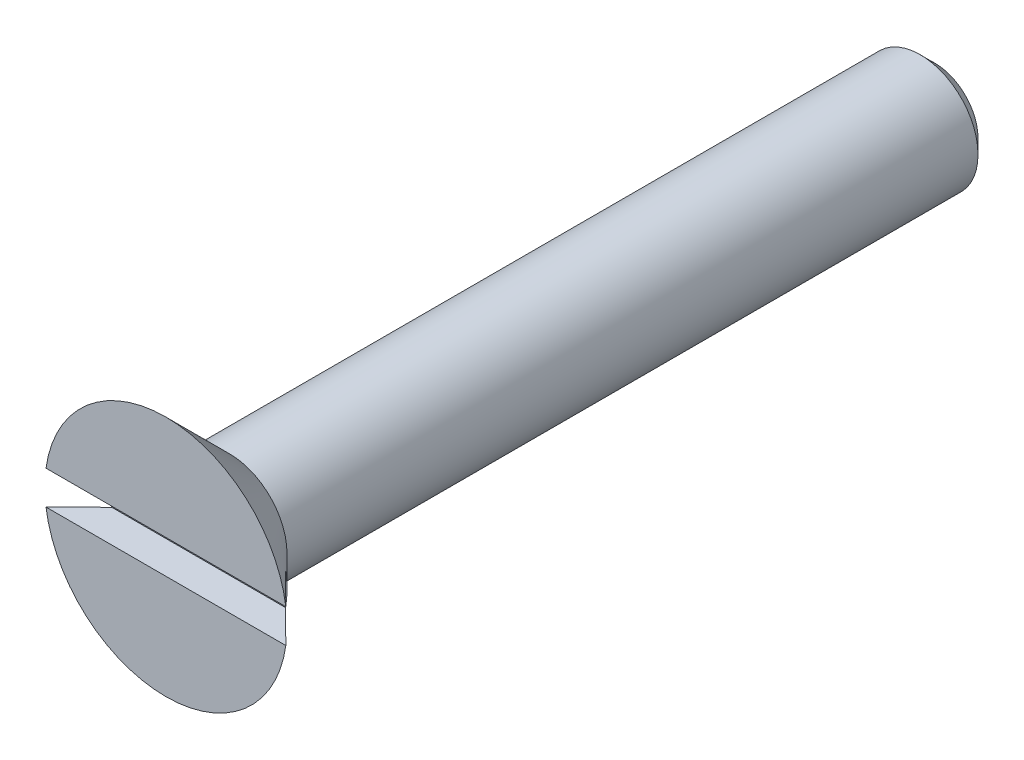
from build123d import *

# Parameters (mm, degrees)
SKETCH9_W          = 6.3
SKETCH9_H          = 0.875
CUT_EXTRUDE1_DEPTH = 0.85


with BuildPart() as part:
    # Sketch3 → Revolve1 (revolve)
    with BuildSketch(Plane(origin=(0, 0, 0), x_dir=(0, 0, -1), z_dir=(1, 0, 0))):
        Polygon((-1.7, 3.15), (-0.05, 1.5), (17.925, 1.5), (18.3, 1.125), (18.3, 0), (-1.7, 0), align=None)
    revolve(axis=Axis((0, 0, 1.7), (0, 0, -1)))

    # Sketch9 → Cut-Extrude1 (cut)
    with BuildSketch(Plane.XY.offset(1.7)):
        Rectangle(SKETCH9_W, SKETCH9_H)
    extrude(amount=-CUT_EXTRUDE1_DEPTH, mode=Mode.SUBTRACT)


solid = part.part
